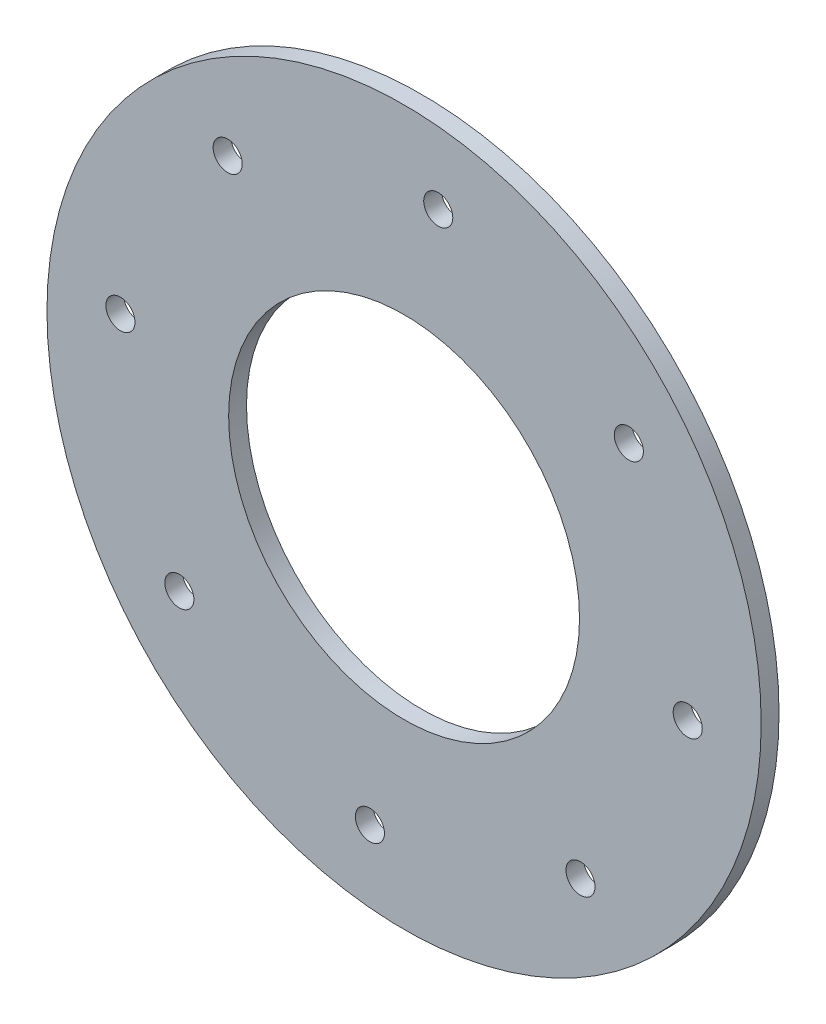
from build123d import *

# Parameters (mm, degrees)
SKETCH1_R           = 60
SKETCH1_R_2         = 29.476887992
SKETCH1_R_3         = 2.443944434
BOSS_EXTRUDE1_DEPTH = 3


with BuildPart() as part:
    # Sketch1 → Boss-Extrude1 (new body)
    with BuildSketch(Plane.XY):
        Circle(SKETCH1_R)
        Circle(SKETCH1_R_2, mode=Mode.SUBTRACT)
        with Locations((-29.63634083, 37.758274619)):
            Circle(SKETCH1_R_3, mode=Mode.SUBTRACT)
        with Locations((5.743074458, 47.6551896)):
            Circle(SKETCH1_R_3, mode=Mode.SUBTRACT)
        with Locations((37.758274619, 29.63634083)):
            Circle(SKETCH1_R_3, mode=Mode.SUBTRACT)
        with Locations((47.6551896, -5.743074458)):
            Circle(SKETCH1_R_3, mode=Mode.SUBTRACT)
        with Locations((29.63634083, -37.758274619)):
            Circle(SKETCH1_R_3, mode=Mode.SUBTRACT)
        with Locations((-5.743074458, -47.6551896)):
            Circle(SKETCH1_R_3, mode=Mode.SUBTRACT)
        with Locations((-37.758274619, -29.63634083)):
            Circle(SKETCH1_R_3, mode=Mode.SUBTRACT)
        with Locations((-47.6551896, 5.743074458)):
            Circle(SKETCH1_R_3, mode=Mode.SUBTRACT)
    extrude(amount=BOSS_EXTRUDE1_DEPTH)


solid = part.part
